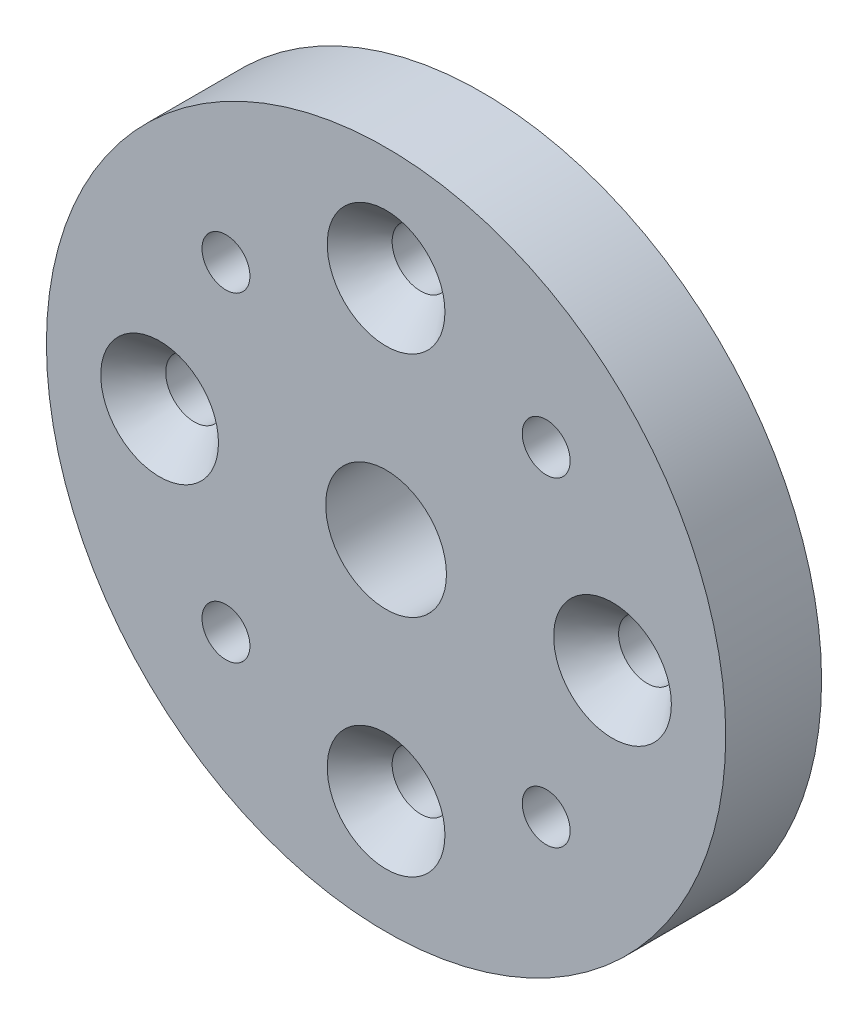
from build123d import *
from OCP.BRepFilletAPI import BRepFilletAPI_MakeChamfer

# Parameters (mm, degrees)
SKETCH1_R           = 22.5
SKETCH1_R_2         = 4
SKETCH1_R_3         = 1.89865
SKETCH1_R_4         = 1.5875
BOSS_EXTRUDE1_DEPTH = 6.35
CHAMFER1_SIZE       = 2.301024407
CHAMFER1_SIZE2      = 2.00025


with BuildPart() as part:
    # Sketch1 → Boss-Extrude1 (new body)
    with BuildSketch(Plane.XY):
        Circle(SKETCH1_R)
        Circle(SKETCH1_R_2, mode=Mode.SUBTRACT)
        with Locations((0, 15)):
            Circle(SKETCH1_R_3, mode=Mode.SUBTRACT)
        with Locations((10.606601718, 10.606601718)):
            Circle(SKETCH1_R_4, mode=Mode.SUBTRACT)
        with Locations((15, 0)):
            Circle(SKETCH1_R_3, mode=Mode.SUBTRACT)
        with Locations((10.606601718, -10.606601718)):
            Circle(SKETCH1_R_4, mode=Mode.SUBTRACT)
        with Locations((0, -15)):
            Circle(SKETCH1_R_3, mode=Mode.SUBTRACT)
        with Locations((-10.606601718, -10.606601718)):
            Circle(SKETCH1_R_4, mode=Mode.SUBTRACT)
        with Locations((-15, 0)):
            Circle(SKETCH1_R_3, mode=Mode.SUBTRACT)
        with Locations((-10.606601718, 10.606601718)):
            Circle(SKETCH1_R_4, mode=Mode.SUBTRACT)
    extrude(amount=BOSS_EXTRUDE1_DEPTH)

    # Chamfer1: one chamfer whose edges measure the first distance from different faces: ONE call of the kernel's chamfer builder (chamfer() names one face for all edges)
    chamfer1_edges_1 = [part.edges().sort_by_distance(p)[0] for p in [
        (13.10135, 0, 6.35),
    ]]
    chamfer1_side_1 = [part.faces().sort_by_distance(p)[0] for p in [
        (13.10135, 0, 3.175),
    ]]
    chamfer1_edges_2 = [part.edges().sort_by_distance(p)[0] for p in [
        (-1.89865, -15, 6.35),
    ]]
    chamfer1_side_2 = [part.faces().sort_by_distance(p)[0] for p in [
        (-1.89865, -15, 3.175),
    ]]
    chamfer1_edges_3 = [part.edges().sort_by_distance(p)[0] for p in [
        (-16.89865, 0, 6.35),
    ]]
    chamfer1_side_3 = [part.faces().sort_by_distance(p)[0] for p in [
        (-16.89865, 0, 3.175),
    ]]
    chamfer1_edges_4 = [part.edges().sort_by_distance(p)[0] for p in [
        (-1.89865, 15, 6.35),
    ]]
    chamfer1_side_4 = [part.faces().sort_by_distance(p)[0] for p in [
        (-1.89865, 15, 3.175),
    ]]
    chamfer1 = BRepFilletAPI_MakeChamfer(part.part.solid().wrapped)
    for e in chamfer1_edges_1:
        chamfer1.Add(CHAMFER1_SIZE, CHAMFER1_SIZE2, e.wrapped, chamfer1_side_1[0].wrapped)  # the first distance lies on this face
    for e in chamfer1_edges_2:
        chamfer1.Add(CHAMFER1_SIZE, CHAMFER1_SIZE2, e.wrapped, chamfer1_side_2[0].wrapped)  # the first distance lies on this face
    for e in chamfer1_edges_3:
        chamfer1.Add(CHAMFER1_SIZE, CHAMFER1_SIZE2, e.wrapped, chamfer1_side_3[0].wrapped)  # the first distance lies on this face
    for e in chamfer1_edges_4:
        chamfer1.Add(CHAMFER1_SIZE, CHAMFER1_SIZE2, e.wrapped, chamfer1_side_4[0].wrapped)  # the first distance lies on this face
    add(Compound.cast(chamfer1.Shape()), mode=Mode.REPLACE)


solid = part.part
